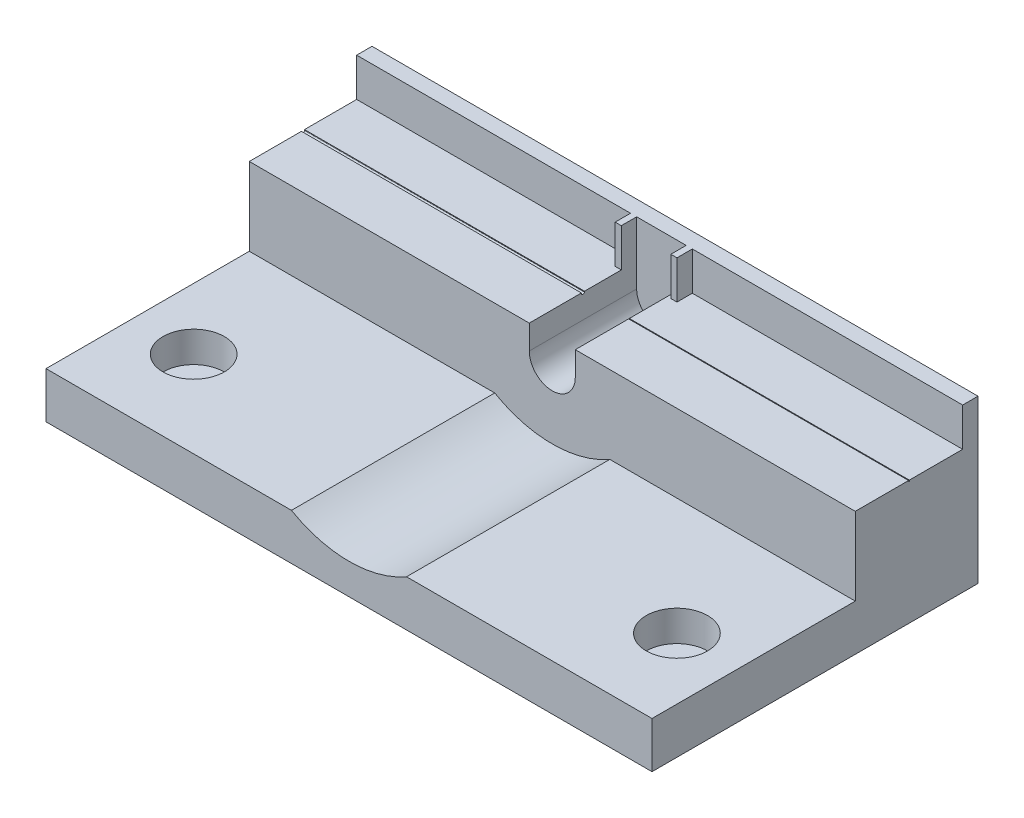
from build123d import *

# Parameters (mm, degrees)
MOTOR_HOLDER_BODY_EXTRUDE_DEPTH          = 13.25
ROLLER_HOLDER_BODY_EXTRUDE_DEPTH         = 7
ALIGNER_4_W                              = 0.4
ALIGNER_4_H                              = 2.5
ALIGNMENT_RAIL_EXTRUDE_DEPTH             = 1
ALIGNER_W                                = 39.5
ALIGNER_H                                = 10.575
ALIGNMENT_WALL_EXTRUDE_DEPTH             = 1
ELECTRODE_GROOVE_CUT_EXTRUDE_DEPTH       = 18.25
FIBRE_GROOVE_CUT_EXTRUDE_DEPTH           = 18.25
ADJUSTMENT_SCREW_HOLES_R                 = 2
ADJUSTMENT_SCREW_HOLES_CUT_EXTRUDE_DEPTH = 2


with BuildPart() as part:
    # MOTOR HOLDER → Motor Holder Body Extrude (new body)
    with BuildSketch(Plane.XY):
        with BuildLine():
            Line((-19.75, -9.5), (19.75, -9.5))
            Line((19.75, -9.5), (19.75, -6.495190528))
            Line((19.75, -6.495190528), (3.75, -6.495190528))
            ThreePointArc((3.75, -6.495190528), (0, -7.5), (-3.75, -6.495190528))
            Line((-3.75, -6.495190528), (-19.75, -6.495190528))
            Line((-19.75, -6.495190528), (-19.75, -9.5))
        make_face()
    extrude(amount=-MOTOR_HOLDER_BODY_EXTRUDE_DEPTH)

    # ROLLER HOLDER → Roller Holder Body Extrude (add)
    with BuildSketch(Plane(origin=(0, 0, -13.25), x_dir=(-1, 0, 0), z_dir=(0, 0, -1))):
        with BuildLine():
            Line((19.75, -9.5), (-19.75, -9.5))
            Line((-19.75, -9.5), (-19.75, -1.425))
            Line((-19.75, -1.425), (-1.5, -1.425))
            Line((-1.5, -1.425), (-1.5, -3))
            ThreePointArc((-1.5, -3), (0, -4.5), (1.5, -3))
            Line((1.5, -3), (1.5, -1.425))
            Line((1.5, -1.425), (19.75, -1.425))
            Line((19.75, -1.425), (19.75, -9.5))
        make_face()
    extrude(amount=ROLLER_HOLDER_BODY_EXTRUDE_DEPTH)

    # ALIGNER<4> → Alignment Rail Extrude (add)
    with BuildSketch(Plane(origin=(0, 0, -20.25), x_dir=(-1, 0, 0), z_dir=(0, 0, -1))):
        with Locations((1.7, -0.175)):
            Rectangle(ALIGNER_4_W, ALIGNER_4_H)
        with Locations((-1.929199775, -0.175)):
            Rectangle(ALIGNER_4_W, ALIGNER_4_H)
    extrude(amount=-ALIGNMENT_RAIL_EXTRUDE_DEPTH)

    # ALIGNER → Alignment Wall Extrude (add)
    with BuildSketch(Plane(origin=(0, 0, -20.25), x_dir=(-1, 0, 0), z_dir=(0, 0, -1))):
        with Locations((0, -4.2125)):
            Rectangle(ALIGNER_W, ALIGNER_H)
    extrude(amount=ALIGNMENT_WALL_EXTRUDE_DEPTH)

    # ELECTRODE GROOVE → Electrode Groove Cut Extrude (cut)
    with BuildSketch(Plane(origin=(19.75, 0, 0), x_dir=(0, 0, -1), z_dir=(1, 0, 0))):
        with BuildLine():
            Line((16.725, -1.425), (16.775, -1.425))
            Line((16.775, -1.425), (16.775, -1.475))
            ThreePointArc((16.775, -1.475), (16.75, -1.5), (16.725, -1.475))
            Line((16.725, -1.475), (16.725, -1.425))
        make_face()
    extrude(amount=-ELECTRODE_GROOVE_CUT_EXTRUDE_DEPTH, mode=Mode.SUBTRACT)

    # FIBRE GROOVE → Fibre Groove Cut Extrude (cut)
    with BuildSketch(Plane.ZY.offset(19.75)):
        with BuildLine():
            Line((-16.85, -1.425), (-16.85, -1.475))
            ThreePointArc((-16.85, -1.475), (-16.75, -1.55698039), (-16.65, -1.475))
            Line((-16.65, -1.475), (-16.65, -1.425))
            Line((-16.65, -1.425), (-16.85, -1.425))
        make_face()
    extrude(amount=-FIBRE_GROOVE_CUT_EXTRUDE_DEPTH, mode=Mode.SUBTRACT)

    # ADJUSTMENT SCREW HOLES → Adjustment Screw Holes Cut Extrude (cut)
    with BuildSketch(Plane(origin=(0, -6.495190528, 0), x_dir=(1, 0, 0), z_dir=(0, 1, 0))):
        with Locations(Location((-15.75, 5.625, 0), (0, 0, 180))):
            Circle(ADJUSTMENT_SCREW_HOLES_R)
        with Locations(Location((15.75, 5.625, 0), (0, 0, 180))):
            Circle(ADJUSTMENT_SCREW_HOLES_R)
    extrude(amount=-ADJUSTMENT_SCREW_HOLES_CUT_EXTRUDE_DEPTH, mode=Mode.SUBTRACT)


solid = part.part
